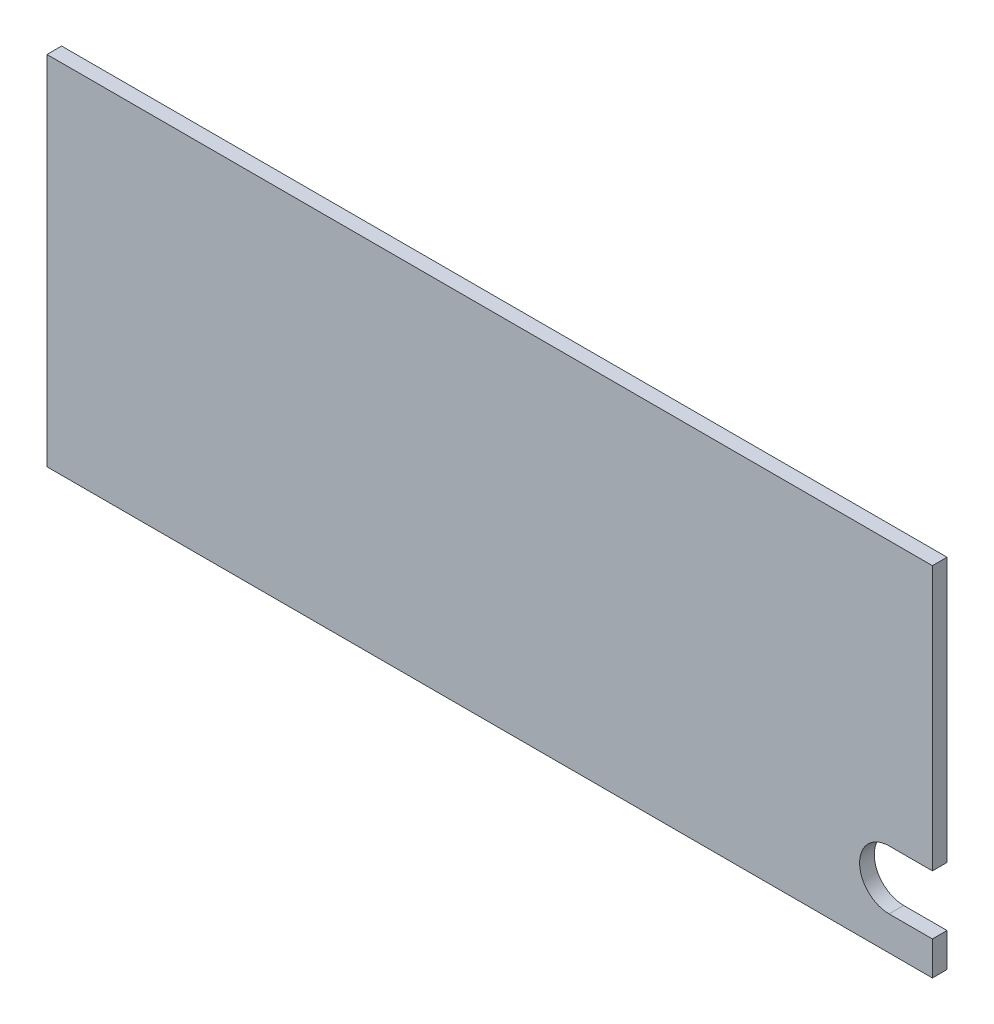
from build123d import *

# Parameters (mm, degrees)
SCHIZZO1_W                   = 121
SCHIZZO1_H                   = 48.8
ESTRUSIONE_ESTRUSIONE1_DEPTH = 2
TAGLIO_ESTRUSIONE1_DEPTH     = 12


with BuildPart() as part:
    # Schizzo1 → Estrusione-Estrusione1 (new body)
    with BuildSketch(Plane.XY):
        with Locations((60.5, 24.4)):
            Rectangle(SCHIZZO1_W, SCHIZZO1_H)
    extrude(amount=ESTRUSIONE_ESTRUSIONE1_DEPTH)

    # Schizzo2 → Taglio-Estrusione1 (cut)
    with BuildSketch(Plane.XY.offset(2)):
        with BuildLine():
            Line((126.922454277, 4.622930456), (115.077545723, 4.622930456))
            ThreePointArc((115.077545723, 4.622930456), (111.052124488, 8.64835169), (115.077545723, 12.673772925))
            Line((115.077545723, 12.673772925), (126.922454277, 12.673772925))
            ThreePointArc((126.922454277, 12.673772925), (130.947875512, 8.64835169), (126.922454277, 4.622930456))
        make_face()
    extrude(amount=-TAGLIO_ESTRUSIONE1_DEPTH, mode=Mode.SUBTRACT)


solid = part.part
